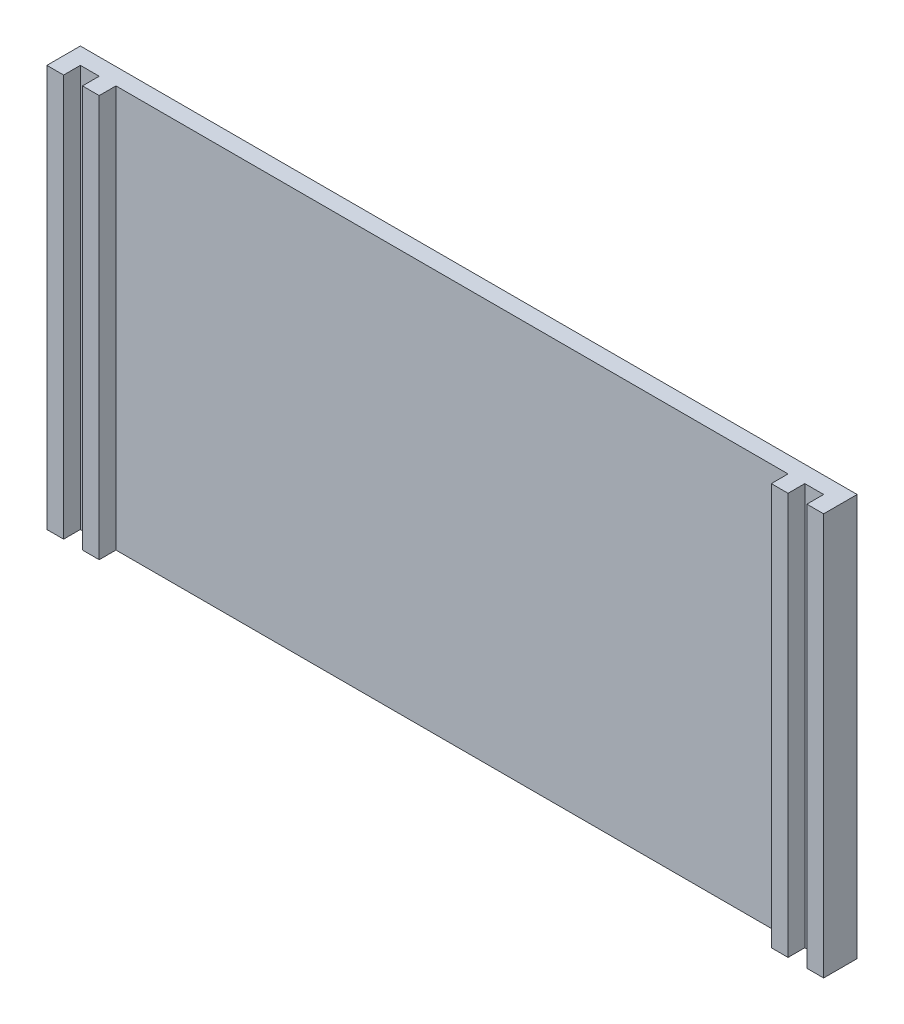
from build123d import *

# Parameters (mm, degrees)
BOSS_EXTRUDE1_DEPTH = 96


with BuildPart() as part:
    # Sketch1 → Boss-Extrude1 (new body)
    with BuildSketch(Plane(origin=(0, 0, 0), x_dir=(1, 0, 0), z_dir=(0, 1, 0))):
        Polygon((-63.408892702, 20.487993735), (122.091107298, 20.487993735), (122.091107298, 12.487993735), (118.091107298, 12.487993735), (118.091107298, 16.487993735), (113.591107298, 16.487993735), (113.591107298, 12.487993735), (109.591107298, 12.487993735), (109.591107298, 16.487993735), (-50.908892702, 16.487993735), (-50.908892702, 12.487993735), (-54.908892702, 12.487993735), (-54.908892702, 16.487993735), (-59.408892702, 16.487993735), (-59.408892702, 12.487993735), (-63.408892702, 12.487993735), align=None)
    extrude(amount=BOSS_EXTRUDE1_DEPTH)


solid = part.part
